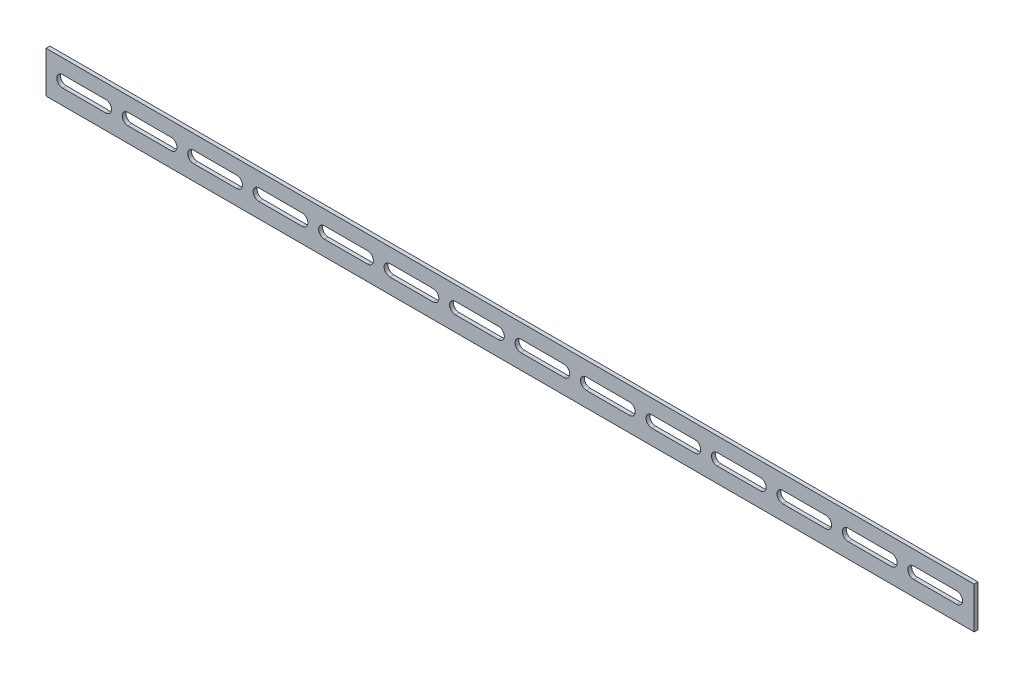
from build123d import *

# Parameters (mm, degrees)
SKETCH_1_W      = 560
SKETCH_1_H      = 25
EXTRUDE_1_DEPTH = 2.3


with BuildPart() as part:
    # ｽｹｯﾁ1 → ﾎﾞｽ - 押し出し1 (new body)
    with BuildSketch(Plane.XY):
        with Locations((0, 12.664243194)):
            Rectangle(SKETCH_1_W, SKETCH_1_H)
        with BuildLine():
            Line((-270, 16.381792792), (-244, 16.381792792))
            ThreePointArc((-244, 16.381792792), (-240.5, 12.881792792), (-244, 9.381792792))
            Line((-244, 9.381792792), (-270, 9.381792792))
            ThreePointArc((-270, 9.381792792), (-273.5, 12.881792792), (-270, 16.381792792))
        make_face(mode=Mode.SUBTRACT)
        with BuildLine():
            Line((-230.5, 16.381792792), (-204.5, 16.381792792))
            ThreePointArc((-204.5, 16.381792792), (-201, 12.881792792), (-204.5, 9.381792792))
            Line((-204.5, 9.381792792), (-230.5, 9.381792792))
            ThreePointArc((-230.5, 9.381792792), (-234, 12.881792792), (-230.5, 16.381792792))
        make_face(mode=Mode.SUBTRACT)
        with BuildLine():
            Line((-191, 16.381792792), (-165, 16.381792792))
            ThreePointArc((-165, 16.381792792), (-161.5, 12.881792792), (-165, 9.381792792))
            Line((-165, 9.381792792), (-191, 9.381792792))
            ThreePointArc((-191, 9.381792792), (-194.5, 12.881792792), (-191, 16.381792792))
        make_face(mode=Mode.SUBTRACT)
        with BuildLine():
            Line((-151.5, 16.381792792), (-125.5, 16.381792792))
            ThreePointArc((-125.5, 16.381792792), (-122, 12.881792792), (-125.5, 9.381792792))
            Line((-125.5, 9.381792792), (-151.5, 9.381792792))
            ThreePointArc((-151.5, 9.381792792), (-155, 12.881792792), (-151.5, 16.381792792))
        make_face(mode=Mode.SUBTRACT)
        with BuildLine():
            Line((-112, 16.381792792), (-86, 16.381792792))
            ThreePointArc((-86, 16.381792792), (-82.5, 12.881792792), (-86, 9.381792792))
            Line((-86, 9.381792792), (-112, 9.381792792))
            ThreePointArc((-112, 9.381792792), (-115.5, 12.881792792), (-112, 16.381792792))
        make_face(mode=Mode.SUBTRACT)
        with BuildLine():
            Line((-72.5, 16.381792792), (-46.5, 16.381792792))
            ThreePointArc((-46.5, 16.381792792), (-43, 12.881792792), (-46.5, 9.381792792))
            Line((-46.5, 9.381792792), (-72.5, 9.381792792))
            ThreePointArc((-72.5, 9.381792792), (-76, 12.881792792), (-72.5, 16.381792792))
        make_face(mode=Mode.SUBTRACT)
        with BuildLine():
            Line((-33, 16.381792792), (-7, 16.381792792))
            ThreePointArc((-7, 16.381792792), (-3.5, 12.881792792), (-7, 9.381792792))
            Line((-7, 9.381792792), (-33, 9.381792792))
            ThreePointArc((-33, 9.381792792), (-36.5, 12.881792792), (-33, 16.381792792))
        make_face(mode=Mode.SUBTRACT)
        with BuildLine():
            Line((6.5, 16.381792792), (32.5, 16.381792792))
            ThreePointArc((32.5, 16.381792792), (36, 12.881792792), (32.5, 9.381792792))
            Line((32.5, 9.381792792), (6.5, 9.381792792))
            ThreePointArc((6.5, 9.381792792), (3, 12.881792792), (6.5, 16.381792792))
        make_face(mode=Mode.SUBTRACT)
        with BuildLine():
            Line((46, 16.381792792), (72, 16.381792792))
            ThreePointArc((72, 16.381792792), (75.5, 12.881792792), (72, 9.381792792))
            Line((72, 9.381792792), (46, 9.381792792))
            ThreePointArc((46, 9.381792792), (42.5, 12.881792792), (46, 16.381792792))
        make_face(mode=Mode.SUBTRACT)
        with BuildLine():
            Line((85.5, 16.381792792), (111.5, 16.381792792))
            ThreePointArc((111.5, 16.381792792), (115, 12.881792792), (111.5, 9.381792792))
            Line((111.5, 9.381792792), (85.5, 9.381792792))
            ThreePointArc((85.5, 9.381792792), (82, 12.881792792), (85.5, 16.381792792))
        make_face(mode=Mode.SUBTRACT)
        with BuildLine():
            Line((125, 16.381792792), (151, 16.381792792))
            ThreePointArc((151, 16.381792792), (154.5, 12.881792792), (151, 9.381792792))
            Line((151, 9.381792792), (125, 9.381792792))
            ThreePointArc((125, 9.381792792), (121.5, 12.881792792), (125, 16.381792792))
        make_face(mode=Mode.SUBTRACT)
        with BuildLine():
            Line((164.5, 16.381792792), (190.5, 16.381792792))
            ThreePointArc((190.5, 16.381792792), (194, 12.881792792), (190.5, 9.381792792))
            Line((190.5, 9.381792792), (164.5, 9.381792792))
            ThreePointArc((164.5, 9.381792792), (161, 12.881792792), (164.5, 16.381792792))
        make_face(mode=Mode.SUBTRACT)
        with BuildLine():
            Line((204, 16.381792792), (230, 16.381792792))
            ThreePointArc((230, 16.381792792), (233.5, 12.881792792), (230, 9.381792792))
            Line((230, 9.381792792), (204, 9.381792792))
            ThreePointArc((204, 9.381792792), (200.5, 12.881792792), (204, 16.381792792))
        make_face(mode=Mode.SUBTRACT)
        with BuildLine():
            Line((243.5, 16.381792792), (269.5, 16.381792792))
            ThreePointArc((269.5, 16.381792792), (273, 12.881792792), (269.5, 9.381792792))
            Line((269.5, 9.381792792), (243.5, 9.381792792))
            ThreePointArc((243.5, 9.381792792), (240, 12.881792792), (243.5, 16.381792792))
        make_face(mode=Mode.SUBTRACT)
    extrude(amount=EXTRUDE_1_DEPTH)


solid = part.part
